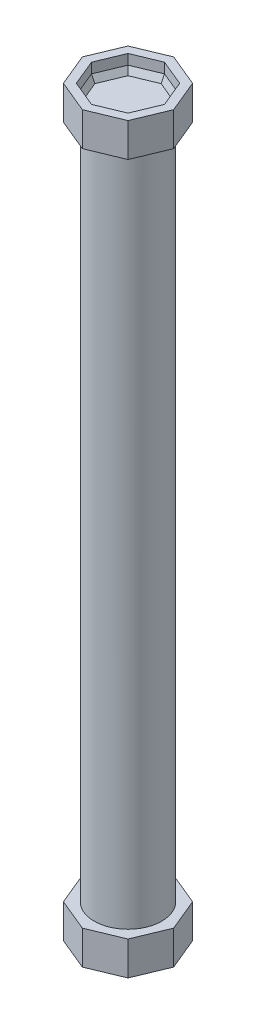
from build123d import *
from OCP.BRepFilletAPI import BRepFilletAPI_MakeChamfer

# Parameters (mm, degrees)
SKETCH1_R           = 12.7
BOSS_EXTRUDE1_DEPTH = 254
BOSS_EXTRUDE2_DEPTH = 12.7
BOSS_EXTRUDE3_DEPTH = 12.7
CUT_EXTRUDE1_DEPTH  = 6.35
CUT_EXTRUDE2_DEPTH  = 6.35
CHAMFER1_SIZE       = 2.54
CHAMFER1_SIZE2      = 1.184421452
CHAMFER2_SIZE       = 2.54
CHAMFER2_SIZE2      = 1.184421452


with BuildPart() as part:
    # Sketch1 → Boss-Extrude1 (new body)
    with BuildSketch(Plane(origin=(0, 0, 0), x_dir=(1, 0, 0), z_dir=(0, 1, 0))):
        with Locations(Location((0, 0, 0), (0, 0, 270))):
            Circle(SKETCH1_R)
    extrude(amount=BOSS_EXTRUDE1_DEPTH)

    # Sketch2 → Boss-Extrude2 (add)
    with BuildSketch(Plane(origin=(0, 254, 0), x_dir=(1, 0, 0), z_dir=(0, 1, 0))):
        Polygon((0, 17.18297618), (-12.150198978, 12.150198978), (-17.18297618, 0), (-12.150198978, -12.150198978), (0, -17.18297618), (12.150198978, -12.150198978), (17.18297618, 0), (12.150198978, 12.150198978), align=None)
    extrude(amount=BOSS_EXTRUDE2_DEPTH)

    # Sketch3 → Boss-Extrude3 (add)
    with BuildSketch(Plane.XZ):
        Polygon((0, 17.18297618), (-12.150198978, 12.150198978), (-17.18297618, 0), (-12.150198978, -12.150198978), (0, -17.18297618), (12.150198978, -12.150198978), (17.18297618, 0), (12.150198978, 12.150198978), align=None)
    extrude(amount=BOSS_EXTRUDE3_DEPTH)

    # Sketch4 → Cut-Extrude1 (cut)
    with BuildSketch(Plane(origin=(0, 266.7, 0), x_dir=(1, 0, 0), z_dir=(0, 1, 0))):
        Polygon((0, 13.746380944), (-9.720159182, 9.720159182), (-13.746380944, 0), (-9.720159182, -9.720159182), (0, -13.746380944), (9.720159182, -9.720159182), (13.746380944, 0), (9.720159182, 9.720159182), align=None)
    extrude(amount=-CUT_EXTRUDE1_DEPTH, mode=Mode.SUBTRACT)

    # Sketch5 → Cut-Extrude2 (cut)
    with BuildSketch(Plane.XZ.offset(12.7)):
        Polygon((0, 13.746380944), (-9.720159182, 9.720159182), (-13.746380944, 0), (-9.720159182, -9.720159182), (0, -13.746380944), (9.720159182, -9.720159182), (13.746380944, 0), (9.720159182, 9.720159182), align=None)
    extrude(amount=-CUT_EXTRUDE2_DEPTH, mode=Mode.SUBTRACT)

    # Chamfer1: one chamfer whose edges measure the first distance from different faces: ONE call of the kernel's chamfer builder (chamfer() names one face for all edges)
    chamfer1_edges_1 = [part.edges().sort_by_distance(p)[0] for p in [
        (4.860079591, -6.35, 11.733270063),
    ]]
    chamfer1_side_1 = [part.faces().sort_by_distance(p)[0] for p in [
        (4.860079591, -9.525, 11.733270063),
    ]]
    chamfer1_edges_2 = [part.edges().sort_by_distance(p)[0] for p in [
        (11.733270063, -6.35, 4.860079591),
    ]]
    chamfer1_side_2 = [part.faces().sort_by_distance(p)[0] for p in [
        (11.733270063, -9.525, 4.860079591),
    ]]
    chamfer1_edges_3 = [part.edges().sort_by_distance(p)[0] for p in [
        (11.733270063, -6.35, -4.860079591),
    ]]
    chamfer1_side_3 = [part.faces().sort_by_distance(p)[0] for p in [
        (11.733270063, -9.525, -4.860079591),
    ]]
    chamfer1_edges_4 = [part.edges().sort_by_distance(p)[0] for p in [
        (4.860079591, -6.35, -11.733270063),
    ]]
    chamfer1_side_4 = [part.faces().sort_by_distance(p)[0] for p in [
        (4.860079591, -9.525, -11.733270063),
    ]]
    chamfer1_edges_5 = [part.edges().sort_by_distance(p)[0] for p in [
        (-4.860079591, -6.35, -11.733270063),
    ]]
    chamfer1_side_5 = [part.faces().sort_by_distance(p)[0] for p in [
        (-4.860079591, -9.525, -11.733270063),
    ]]
    chamfer1_edges_6 = [part.edges().sort_by_distance(p)[0] for p in [
        (-11.733270063, -6.35, -4.860079591),
    ]]
    chamfer1_side_6 = [part.faces().sort_by_distance(p)[0] for p in [
        (-11.733270063, -9.525, -4.860079591),
    ]]
    chamfer1_edges_7 = [part.edges().sort_by_distance(p)[0] for p in [
        (-11.733270063, -6.35, 4.860079591),
    ]]
    chamfer1_side_7 = [part.faces().sort_by_distance(p)[0] for p in [
        (-11.733270063, -9.525, 4.860079591),
    ]]
    chamfer1_edges_8 = [part.edges().sort_by_distance(p)[0] for p in [
        (-4.860079591, -6.35, 11.733270063),
    ]]
    chamfer1_side_8 = [part.faces().sort_by_distance(p)[0] for p in [
        (-4.860079591, -9.525, 11.733270063),
    ]]
    chamfer1 = BRepFilletAPI_MakeChamfer(part.part.solid().wrapped)
    for e in chamfer1_edges_1:
        chamfer1.Add(CHAMFER1_SIZE, CHAMFER1_SIZE2, e.wrapped, chamfer1_side_1[0].wrapped)  # the first distance lies on this face
    for e in chamfer1_edges_2:
        chamfer1.Add(CHAMFER1_SIZE, CHAMFER1_SIZE2, e.wrapped, chamfer1_side_2[0].wrapped)  # the first distance lies on this face
    for e in chamfer1_edges_3:
        chamfer1.Add(CHAMFER1_SIZE, CHAMFER1_SIZE2, e.wrapped, chamfer1_side_3[0].wrapped)  # the first distance lies on this face
    for e in chamfer1_edges_4:
        chamfer1.Add(CHAMFER1_SIZE, CHAMFER1_SIZE2, e.wrapped, chamfer1_side_4[0].wrapped)  # the first distance lies on this face
    for e in chamfer1_edges_5:
        chamfer1.Add(CHAMFER1_SIZE, CHAMFER1_SIZE2, e.wrapped, chamfer1_side_5[0].wrapped)  # the first distance lies on this face
    for e in chamfer1_edges_6:
        chamfer1.Add(CHAMFER1_SIZE, CHAMFER1_SIZE2, e.wrapped, chamfer1_side_6[0].wrapped)  # the first distance lies on this face
    for e in chamfer1_edges_7:
        chamfer1.Add(CHAMFER1_SIZE, CHAMFER1_SIZE2, e.wrapped, chamfer1_side_7[0].wrapped)  # the first distance lies on this face
    for e in chamfer1_edges_8:
        chamfer1.Add(CHAMFER1_SIZE, CHAMFER1_SIZE2, e.wrapped, chamfer1_side_8[0].wrapped)  # the first distance lies on this face
    add(Compound.cast(chamfer1.Shape()), mode=Mode.REPLACE)

    # Chamfer2: one chamfer whose edges measure the first distance from different faces: ONE call of the kernel's chamfer builder (chamfer() names one face for all edges)
    chamfer2_edges_1 = [part.edges().sort_by_distance(p)[0] for p in [
        (4.860079591, 260.35, -11.733270063),
    ]]
    chamfer2_side_1 = [part.faces().sort_by_distance(p)[0] for p in [
        (4.860079591, 263.525, -11.733270063),
    ]]
    chamfer2_edges_2 = [part.edges().sort_by_distance(p)[0] for p in [
        (11.733270063, 260.35, -4.860079591),
    ]]
    chamfer2_side_2 = [part.faces().sort_by_distance(p)[0] for p in [
        (11.733270063, 263.525, -4.860079591),
    ]]
    chamfer2_edges_3 = [part.edges().sort_by_distance(p)[0] for p in [
        (11.733270063, 260.35, 4.860079591),
    ]]
    chamfer2_side_3 = [part.faces().sort_by_distance(p)[0] for p in [
        (11.733270063, 263.525, 4.860079591),
    ]]
    chamfer2_edges_4 = [part.edges().sort_by_distance(p)[0] for p in [
        (4.860079591, 260.35, 11.733270063),
    ]]
    chamfer2_side_4 = [part.faces().sort_by_distance(p)[0] for p in [
        (4.860079591, 263.525, 11.733270063),
    ]]
    chamfer2_edges_5 = [part.edges().sort_by_distance(p)[0] for p in [
        (-4.860079591, 260.35, 11.733270063),
    ]]
    chamfer2_side_5 = [part.faces().sort_by_distance(p)[0] for p in [
        (-4.860079591, 263.525, 11.733270063),
    ]]
    chamfer2_edges_6 = [part.edges().sort_by_distance(p)[0] for p in [
        (-11.733270063, 260.35, 4.860079591),
    ]]
    chamfer2_side_6 = [part.faces().sort_by_distance(p)[0] for p in [
        (-11.733270063, 263.525, 4.860079591),
    ]]
    chamfer2_edges_7 = [part.edges().sort_by_distance(p)[0] for p in [
        (-11.733270063, 260.35, -4.860079591),
    ]]
    chamfer2_side_7 = [part.faces().sort_by_distance(p)[0] for p in [
        (-11.733270063, 263.525, -4.860079591),
    ]]
    chamfer2_edges_8 = [part.edges().sort_by_distance(p)[0] for p in [
        (-4.860079591, 260.35, -11.733270063),
    ]]
    chamfer2_side_8 = [part.faces().sort_by_distance(p)[0] for p in [
        (-4.860079591, 263.525, -11.733270063),
    ]]
    chamfer2 = BRepFilletAPI_MakeChamfer(part.part.solid().wrapped)
    for e in chamfer2_edges_1:
        chamfer2.Add(CHAMFER2_SIZE, CHAMFER2_SIZE2, e.wrapped, chamfer2_side_1[0].wrapped)  # the first distance lies on this face
    for e in chamfer2_edges_2:
        chamfer2.Add(CHAMFER2_SIZE, CHAMFER2_SIZE2, e.wrapped, chamfer2_side_2[0].wrapped)  # the first distance lies on this face
    for e in chamfer2_edges_3:
        chamfer2.Add(CHAMFER2_SIZE, CHAMFER2_SIZE2, e.wrapped, chamfer2_side_3[0].wrapped)  # the first distance lies on this face
    for e in chamfer2_edges_4:
        chamfer2.Add(CHAMFER2_SIZE, CHAMFER2_SIZE2, e.wrapped, chamfer2_side_4[0].wrapped)  # the first distance lies on this face
    for e in chamfer2_edges_5:
        chamfer2.Add(CHAMFER2_SIZE, CHAMFER2_SIZE2, e.wrapped, chamfer2_side_5[0].wrapped)  # the first distance lies on this face
    for e in chamfer2_edges_6:
        chamfer2.Add(CHAMFER2_SIZE, CHAMFER2_SIZE2, e.wrapped, chamfer2_side_6[0].wrapped)  # the first distance lies on this face
    for e in chamfer2_edges_7:
        chamfer2.Add(CHAMFER2_SIZE, CHAMFER2_SIZE2, e.wrapped, chamfer2_side_7[0].wrapped)  # the first distance lies on this face
    for e in chamfer2_edges_8:
        chamfer2.Add(CHAMFER2_SIZE, CHAMFER2_SIZE2, e.wrapped, chamfer2_side_8[0].wrapped)  # the first distance lies on this face
    add(Compound.cast(chamfer2.Shape()), mode=Mode.REPLACE)


solid = part.part
